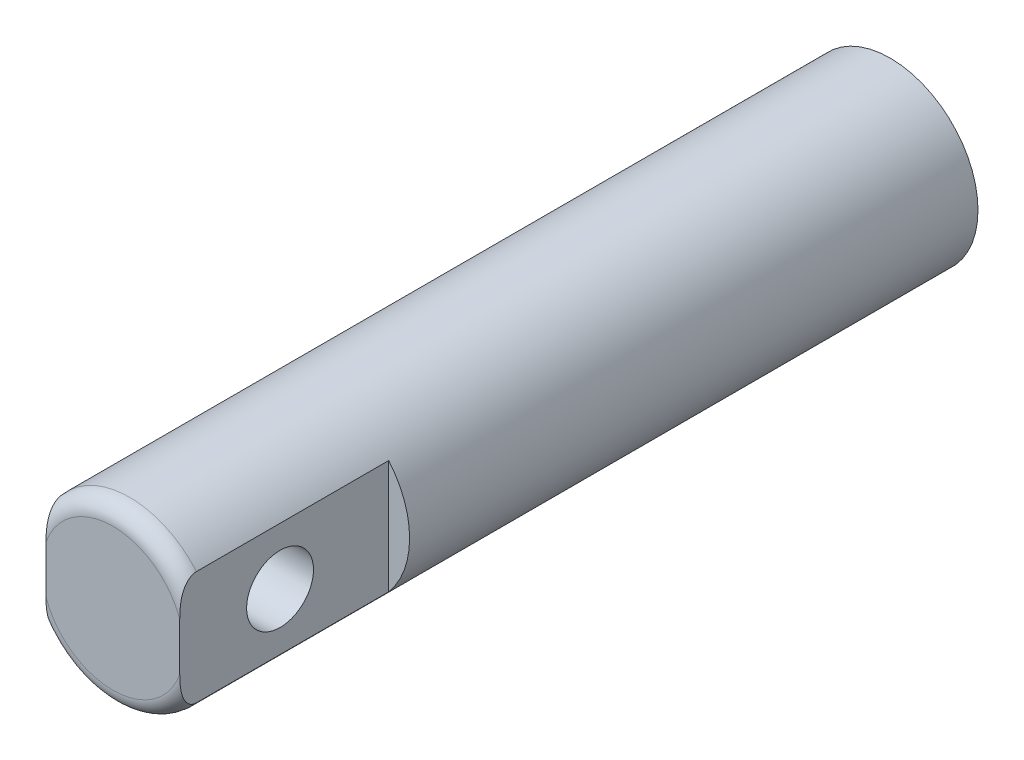
from build123d import *

# Parameters (mm, degrees)
SKETCH_1_R          = 10.5
EXTRUDE_1_DEPTH     = 93
SKETCH_2_R          = 5.25
CUT_EXTRUDE_2_DEPTH = 70
FILLET_1_R          = 2
SKETCH_3_W          = 11
SKETCH_3_H          = 25
CUT_EXTRUDE_3_DEPTH = 15
SKETCH_4_R          = 4
CUT_EXTRUDE_4_DEPTH = 15


with BuildPart() as part:
    # Эскиз1 → Вытянуть1 (new body)
    with BuildSketch(Plane.XY):
        with Locations(Location((0, 0, 0), (0, 0, 180))):
            Circle(SKETCH_1_R)
    extrude(amount=EXTRUDE_1_DEPTH)

    # Эскиз2 → Вытянуть2 (cut)
    with BuildSketch(Plane(origin=(0, 0, 0), x_dir=(-1, 0, 0), z_dir=(0, 0, -1))):
        Circle(SKETCH_2_R)
    extrude(amount=-CUT_EXTRUDE_2_DEPTH, mode=Mode.SUBTRACT)

    # Скругление1
    fillet_1_edges = [part.edges().sort_by_distance(p)[0] for p in [
        (10.5, 0, 93),
    ]]
    fillet(fillet_1_edges, radius=FILLET_1_R)

    # Эскиз3 → Вытянуть3 (cut, symmetric)
    with BuildSketch(Plane(origin=(0, 0, 0), x_dir=(1, 0, 0), z_dir=(0, 1, 0))):
        with Locations((-13.5, -80.5)):
            Rectangle(SKETCH_3_W, SKETCH_3_H)
        with Locations((13.5, -80.5)):
            Rectangle(SKETCH_3_W, SKETCH_3_H)
    extrude(amount=CUT_EXTRUDE_3_DEPTH, both=True, mode=Mode.SUBTRACT)

    # Эскиз4 → Вытянуть4 (cut, symmetric)
    with BuildSketch(Plane(origin=(0, 0, 0), x_dir=(0, 0, -1), z_dir=(1, 0, 0))):
        with Locations((-81, 0)):
            Circle(SKETCH_4_R)
    extrude(amount=CUT_EXTRUDE_4_DEPTH, both=True, mode=Mode.SUBTRACT)


solid = part.part
